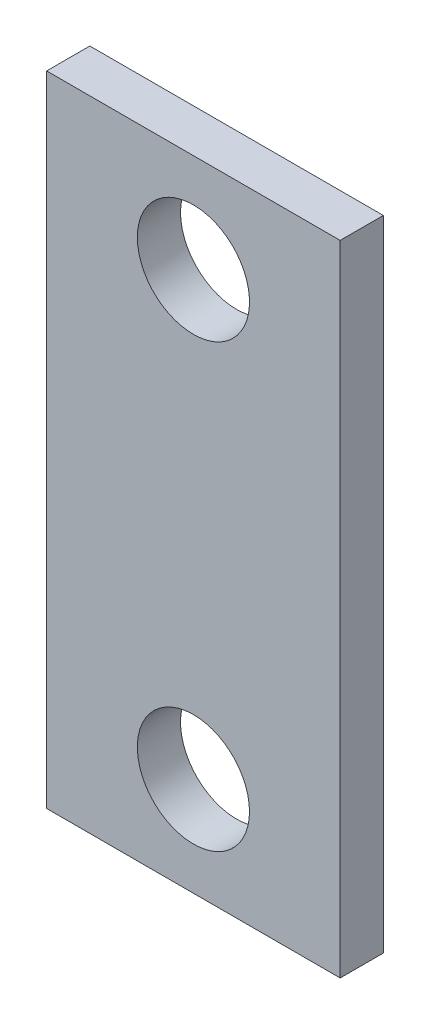
from build123d import *

# Parameters (mm, degrees)
SKETCH1_W           = 21.59
SKETCH1_H           = 46.99
SKETCH1_R           = 4.124999878
BOSS_EXTRUDE1_DEPTH = 3.175


with BuildPart() as part:
    # Sketch1 → Boss-Extrude1 (new body)
    with BuildSketch(Plane.XY):
        with Locations((10.795, 23.495)):
            Rectangle(SKETCH1_W, SKETCH1_H)
        with Locations((10.795, 7.260198401)):
            Circle(SKETCH1_R, mode=Mode.SUBTRACT)
        with Locations(Location((10.795, 39.729801599, 0), (0, 0, 180))):
            Circle(SKETCH1_R, mode=Mode.SUBTRACT)
    extrude(amount=BOSS_EXTRUDE1_DEPTH)


solid = part.part
